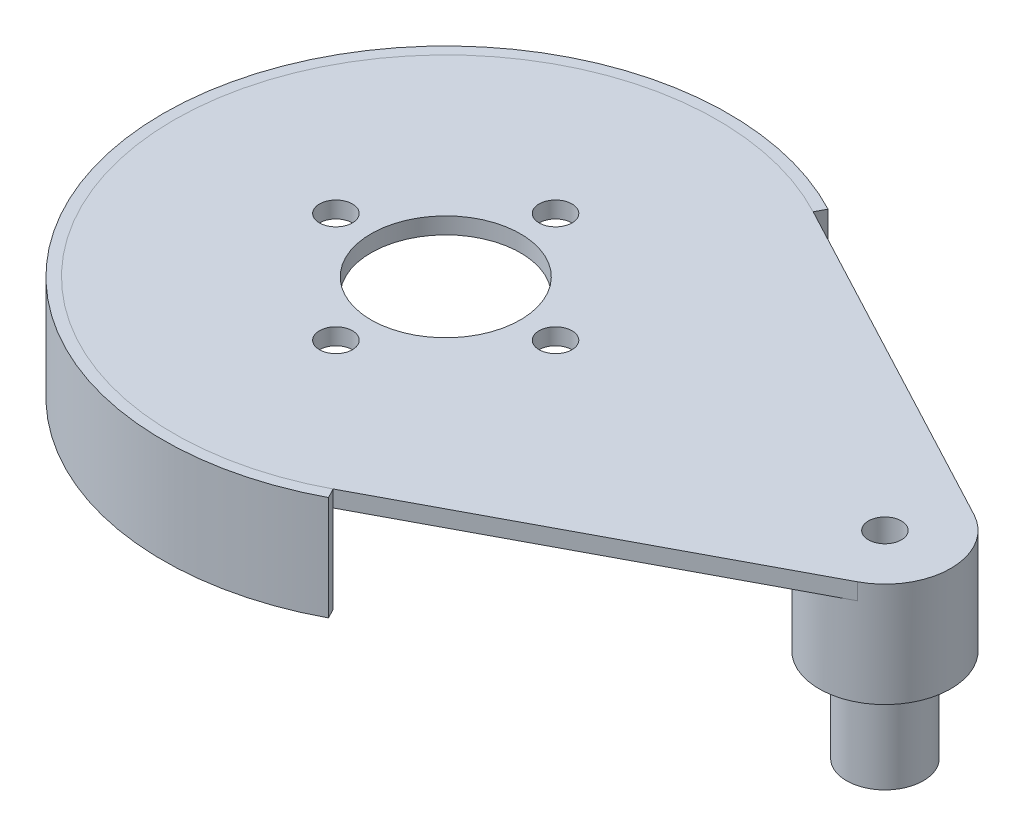
from build123d import *
from build123d.topology import SkipClean

# Parameters (mm, degrees)
EXTRUDE_1_DEPTH      = 1.5
EXTRUDE_2_DEPTH      = 8
EXTRUDE_2_DEPTH_BACK = 1.5
SKETCH_5_R           = 6.8
SKETCH_5_R_2         = 1.5
CUT_EXTRUDE_1_DEPTH  = 54.565964007
EXTRUDE_START        = 8
SKETCH_6_R           = 6
EXTRUDE_3_DEPTH      = 8
SKETCH_7_R           = 3.5
EXTRUDE_4_DEPTH      = 8.5
SKETCH_9_R           = 1.5
CUT_EXTRUDE_2_DEPTH  = 56.705138901


with BuildPart() as part:
    # 草图2 → 凸台-拉伸1 (new body)
    with BuildSketch(Plane(origin=(0, 0, 0), x_dir=(1, 0, 0), z_dir=(0, 1, 0))):
        with BuildLine():
            Line((42.8125, 5.299985259), (11.6015625, 21.862439195))
            ThreePointArc((11.6015625, 21.862439195), (-24.75, 0), (11.6015625, -21.862439195))
            Line((11.6015625, -21.862439195), (42.8125, -5.299985259))
            ThreePointArc((42.8125, -5.299985259), (46, 0), (42.8125, 5.299985259))
        make_face()
    extrude(amount=EXTRUDE_1_DEPTH)

    # 草图5 → 切除-拉伸1 (cut, through all)
    with BuildSketch(Plane(origin=(0, 1.5, 0), x_dir=(1, 0, 0), z_dir=(0, 1, 0))):
        with Locations(Location((0, 0, 0), (0, 0, 270))):
            Circle(SKETCH_5_R)
        with Locations(Location((0, 10, 0), (0, 0, 270))):
            Circle(SKETCH_5_R_2)
        with Locations(Location((10, 0, 0), (0, 0, 270))):
            Circle(SKETCH_5_R_2)
        with Locations(Location((0, -10, 0), (0, 0, 270))):
            Circle(SKETCH_5_R_2)
        with Locations(Location((-10, 0, 0), (0, 0, 270))):
            Circle(SKETCH_5_R_2)
    extrude(amount=-CUT_EXTRUDE_1_DEPTH, mode=Mode.SUBTRACT)

    # 草图6 → 凸台-拉伸3 (add)
    with SkipClean():  # the faces are left unmerged after this step: merging them gives an invalid solid
        with BuildSketch(Plane.XZ.offset(EXTRUDE_START)):
            with Locations(Location((40, 0, 0), (0, 0, 270))):
                Circle(SKETCH_6_R)
        extrude(amount=-EXTRUDE_3_DEPTH)

    # 草图7 → 凸台-拉伸4 (add)
    with SkipClean():  # the faces are left unmerged after this step: merging them gives an invalid solid
        with BuildSketch(Plane.XZ.offset(8)):
            with Locations(Location((40, 0, 0), (0, 0, 270))):
                Circle(SKETCH_7_R)
        extrude(amount=EXTRUDE_4_DEPTH)

    # 草图9 → 切除-拉伸2 (cut, through all)
    with SkipClean():  # the faces are left unmerged after this step: merging them gives an invalid solid
        with BuildSketch(Plane.XZ.offset(16.5)):
            with Locations(Location((40, 0, 0), (0, 0, 270))):
                Circle(SKETCH_9_R)
        extrude(amount=-CUT_EXTRUDE_2_DEPTH, mode=Mode.SUBTRACT)


with BuildPart() as body_2:
    # 草图3 → 凸台-拉伸2 (new, two sides: drawn at the far end of the back side and taken through both)
    with BuildSketch(Plane.XZ.offset(-EXTRUDE_2_DEPTH_BACK)):
        with BuildLine():
            ThreePointArc((11.6015625, -21.862439195), (-24.75, 0), (11.6015625, 21.862439195))
            Line((11.6015625, 21.862439195), (12.0703125, 22.745770072))
            ThreePointArc((12.0703125, 22.745770072), (-25.75, 0), (12.0703125, -22.745770072))
            Line((12.0703125, -22.745770072), (11.6015625, -21.862439195))
        make_face()
    extrude(amount=EXTRUDE_2_DEPTH + EXTRUDE_2_DEPTH_BACK)


solid = Compound([part.part, body_2.part])
